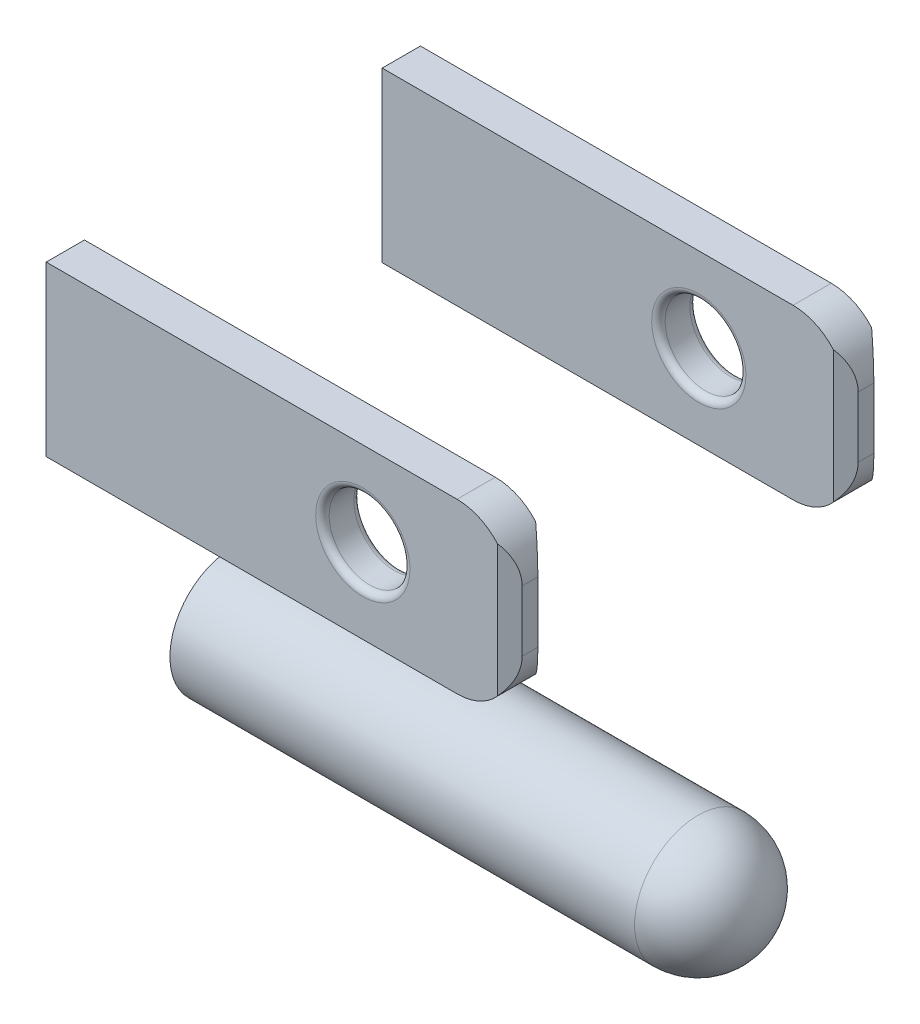
from build123d import *
from OCP.BRepFilletAPI import BRepFilletAPI_MakeChamfer

# Parameters (mm, degrees)
SKETCH1_R             = 2.355
BOSS_EXTRUDE1_DEPTH   = 17.26
SKETCH1_W             = 1.42
SKETCH1_H             = 6.26
BOSS_EXTRUDE1_2_DEPTH = 17.26
BOSS_EXTRUDE1_3_DEPTH = 17.26
CHAMFER1_SIZE         = 0.5
CHAMFER1_SIZE2        = 0.419549816
CHAMFER2_SIZE         = 0.5
CHAMFER2_SIZE2        = 0.419549816
FILLET1_R             = 2
FILLET2_R             = 2
DOME1_FACE_RADIUS     = 2.355
DOME1_HEIGHT          = 2.35
SKETCH2_R             = 1.5
CUT_EXTRUDE1_DEPTH    = 21
FILLET3_R             = 0.25
FILLET4_R             = 0.25


with BuildPart() as part:
    # Sketch1 → Boss-Extrude1 (new body)
    with BuildSketch(Plane(origin=(0, 0, 0), x_dir=(0, 0, -1), z_dir=(1, 0, 0))):
        with Locations((0, -8.06)):
            Circle(SKETCH1_R)
    extrude(amount=BOSS_EXTRUDE1_DEPTH)

    # Dome1: a dome of height H over a round flat face of radius A is a cap of a sphere of radius (A * A + H * H) / (2 * H)
    dome1_r = (DOME1_FACE_RADIUS * DOME1_FACE_RADIUS + DOME1_HEIGHT * DOME1_HEIGHT) / (2 * DOME1_HEIGHT)
    dome1_base = Plane((17.26, -8.06, 0), z_dir=(1, 0, 0))
    with Locations(dome1_base.offset(DOME1_HEIGHT - dome1_r)):
        dome1_ball = Sphere(dome1_r, mode=Mode.PRIVATE)
    add(split(dome1_ball, bisect_by=dome1_base, keep=Keep.TOP, mode=Mode.PRIVATE))


with BuildPart() as body_2:
    # Sketch1 → Boss-Extrude1 2 (new body)
    with BuildSketch(Plane(origin=(0, 0, 0), x_dir=(0, 0, -1), z_dir=(1, 0, 0))):
        with Locations((6.24, 3.805)):
            Rectangle(SKETCH1_W, SKETCH1_H)
    extrude(amount=BOSS_EXTRUDE1_2_DEPTH)

    # Chamfer2: one chamfer whose edges measure the first distance from different faces: ONE call of the kernel's chamfer builder (chamfer() names one face for all edges)
    chamfer2_edges_1 = [body_2.edges().sort_by_distance(p)[0] for p in [
        (17.26, 3.805, -5.53),
    ]]
    chamfer2_side_1 = [body_2.faces().sort_by_distance(p)[0] for p in [
        (8.63, 3.805, -5.53),
    ]]
    chamfer2_edges_2 = [body_2.edges().sort_by_distance(p)[0] for p in [
        (17.26, 3.805, -6.95),
    ]]
    chamfer2_side_2 = [body_2.faces().sort_by_distance(p)[0] for p in [
        (8.63, 3.805, -6.95),
    ]]
    chamfer2 = BRepFilletAPI_MakeChamfer(body_2.part.solid().wrapped)
    for e in chamfer2_edges_1:
        chamfer2.Add(CHAMFER2_SIZE, CHAMFER2_SIZE2, e.wrapped, chamfer2_side_1[0].wrapped)  # the first distance lies on this face
    for e in chamfer2_edges_2:
        chamfer2.Add(CHAMFER2_SIZE, CHAMFER2_SIZE2, e.wrapped, chamfer2_side_2[0].wrapped)  # the first distance lies on this face
    add(Compound.cast(chamfer2.Shape()), mode=Mode.REPLACE)

    # Fillet2
    fillet2_edges = [body_2.edges().sort_by_distance(p)[0] for p in [
        (17.26, 0.675, -6.24),
        (17.26, 6.935, -6.24),
    ]]
    fillet(fillet2_edges, radius=FILLET2_R)


with BuildPart() as body_3:
    # Sketch1 → Boss-Extrude1 3 (new body)
    with BuildSketch(Plane(origin=(0, 0, 0), x_dir=(0, 0, -1), z_dir=(1, 0, 0))):
        with Locations((-6.24, 3.805)):
            Rectangle(SKETCH1_W, SKETCH1_H)
    extrude(amount=BOSS_EXTRUDE1_3_DEPTH)

    # Chamfer1: one chamfer whose edges measure the first distance from different faces: ONE call of the kernel's chamfer builder (chamfer() names one face for all edges)
    chamfer1_edges_1 = [body_3.edges().sort_by_distance(p)[0] for p in [
        (17.26, 3.805, 6.95),
    ]]
    chamfer1_side_1 = [body_3.faces().sort_by_distance(p)[0] for p in [
        (8.63, 3.805, 6.95),
    ]]
    chamfer1_edges_2 = [body_3.edges().sort_by_distance(p)[0] for p in [
        (17.26, 3.805, 5.53),
    ]]
    chamfer1_side_2 = [body_3.faces().sort_by_distance(p)[0] for p in [
        (8.63, 3.805, 5.53),
    ]]
    chamfer1 = BRepFilletAPI_MakeChamfer(body_3.part.solid().wrapped)
    for e in chamfer1_edges_1:
        chamfer1.Add(CHAMFER1_SIZE, CHAMFER1_SIZE2, e.wrapped, chamfer1_side_1[0].wrapped)  # the first distance lies on this face
    for e in chamfer1_edges_2:
        chamfer1.Add(CHAMFER1_SIZE, CHAMFER1_SIZE2, e.wrapped, chamfer1_side_2[0].wrapped)  # the first distance lies on this face
    add(Compound.cast(chamfer1.Shape()), mode=Mode.REPLACE)

    # Fillet1
    fillet1_edges = [body_3.edges().sort_by_distance(p)[0] for p in [
        (17.26, 6.935, 6.24),
        (17.26, 0.675, 6.24),
    ]]
    fillet(fillet1_edges, radius=FILLET1_R)


with BuildPart() as cut_extrude1_tool:
    # Sketch2 → Cut-Extrude1 (new body)
    with BuildSketch(Plane.XY.offset(6.95)):
        with Locations((11.76, 3.805)):
            Circle(SKETCH2_R)
    extrude(amount=-CUT_EXTRUDE1_DEPTH)


with BuildPart() as body_2_1:
    add(body_2.part)

    # Cut-Extrude1: cut by cut_extrude1_tool
    add(cut_extrude1_tool.part, mode=Mode.SUBTRACT)

    # Fillet3
    fillet3_edges = [body_2_1.edges().sort_by_distance(p)[0] for p in [
        (10.26, 3.805, -5.53),
        (10.26, 3.805, -6.95),
    ]]
    fillet(fillet3_edges, radius=FILLET3_R)


with BuildPart() as body_3_1:
    add(body_3.part)

    # Cut-Extrude1: cut by cut_extrude1_tool
    add(cut_extrude1_tool.part, mode=Mode.SUBTRACT)

    # Fillet4
    fillet4_edges = [body_3_1.edges().sort_by_distance(p)[0] for p in [
        (10.26, 3.805, 5.53),
        (10.26, 3.805, 6.95),
    ]]
    fillet(fillet4_edges, radius=FILLET4_R)


solid = Compound([part.part, body_2_1.part, body_3_1.part])
